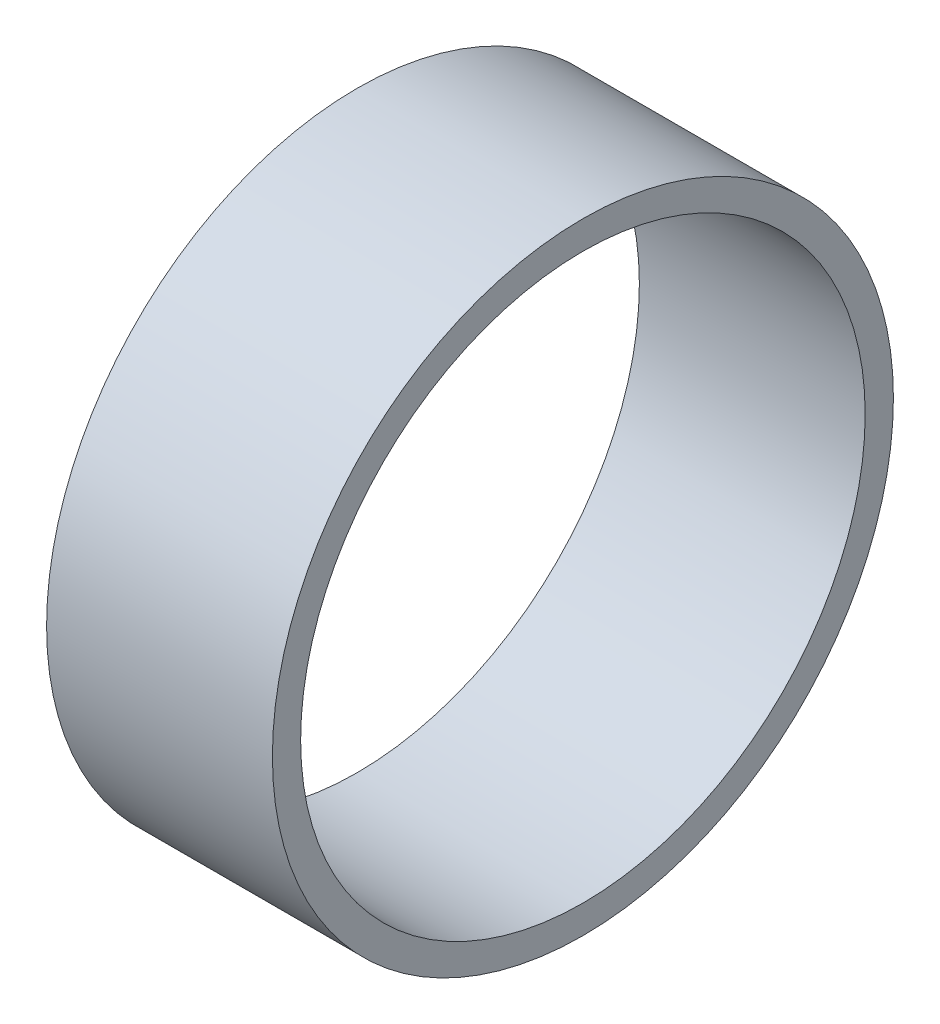
from build123d import *

# Parameters (mm, degrees)
SKETCH_1_R      = 27.5
SKETCH_1_R_2    = 25
EXTRUDE_1_DEPTH = 20


with BuildPart() as part:
    # 草图1 → 凸台-拉伸1 (new body)
    with BuildSketch(Plane(origin=(0, 0, 0), x_dir=(0, 0, -1), z_dir=(1, 0, 0))):
        Circle(SKETCH_1_R)
        Circle(SKETCH_1_R_2, mode=Mode.SUBTRACT)
    extrude(amount=EXTRUDE_1_DEPTH)


solid = part.part
